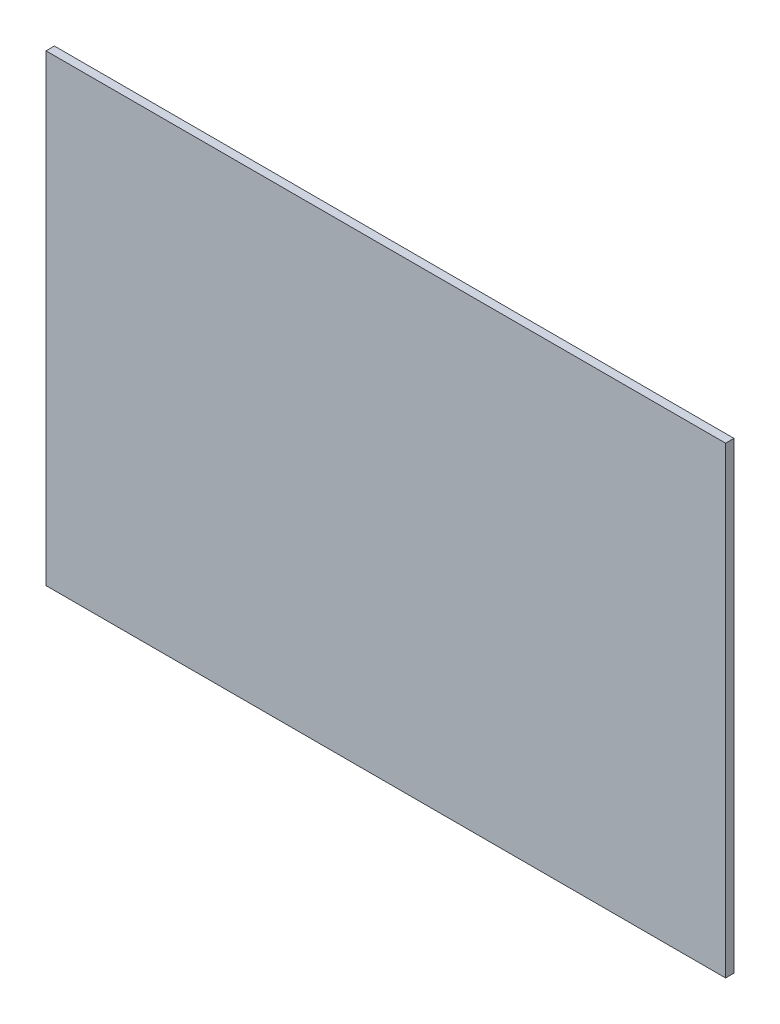
from build123d import *

# Parameters (mm, degrees)
SKETCH1_W           = 65
SKETCH1_H           = 44.300398157
BOSS_EXTRUDE1_DEPTH = 0.8


with BuildPart() as part:
    # Sketch1 → Boss-Extrude1 (new body)
    with BuildSketch(Plane.XY):
        with Locations((-7.461848498, -14.149443471)):
            Rectangle(SKETCH1_W, SKETCH1_H)
    extrude(amount=BOSS_EXTRUDE1_DEPTH)


solid = part.part
